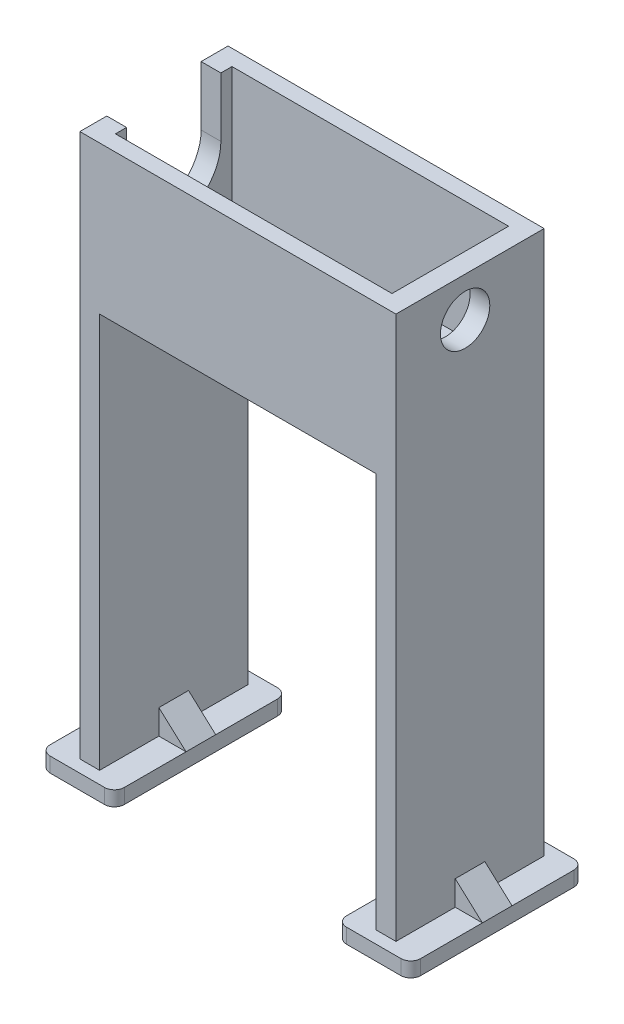
from build123d import *

# Parameters (mm, degrees)
SALIENTE_EXTRUIR1_DEPTH      = 3
SALIENTE_EXTRUIR1_2_DEPTH    = 3
SALIENTE_EXTRUIR2_DEPTH      = 3
SALIENTE_EXTRUIR2_DEPTH_BACK = 3
CROQUIS4_W                   = 4
CROQUIS4_H                   = 30
SALIENTE_EXTRUIR3_DEPTH      = 110
SALIENTE_EXTRUIR4_DEPTH      = 56
CORTAR_EXTRUIR1_DEPTH        = 4
CROQUIS7_R                   = 5
CORTAR_EXTRUIR2_DEPTH        = 4


with BuildPart() as part:
    # Croquis2 → Saliente-Extruir1 (new body)
    with BuildSketch(Plane(origin=(0, 0, 0), x_dir=(1, 0, 0), z_dir=(0, 1, 0))):
        with BuildLine():
            Line((-5.5, -17.5), (5.5, -17.5))
            ThreePointArc((5.5, -17.5), (6.914213562, -16.914213562), (7.5, -15.5))
            Line((7.5, -15.5), (7.5, 15.5))
            ThreePointArc((7.5, 15.5), (6.914213562, 16.914213562), (5.5, 17.5))
            Line((5.5, 17.5), (-5.5, 17.5))
            ThreePointArc((-5.5, 17.5), (-6.914213562, 16.914213562), (-7.5, 15.5))
            Line((-7.5, 15.5), (-7.5, -15.5))
            ThreePointArc((-7.5, -15.5), (-6.914213562, -16.914213562), (-5.5, -17.5))
        make_face()
    extrude(amount=SALIENTE_EXTRUIR1_DEPTH)



with BuildPart() as body_2:
    # Croquis2 → Saliente-Extruir1 2 (new body)
    with BuildSketch(Plane(origin=(0, 0, 0), x_dir=(1, 0, 0), z_dir=(0, 1, 0))):
        with BuildLine():
            Line((52.5, -15.5), (52.5, 15.5))
            ThreePointArc((52.5, 15.5), (53.085786438, 16.914213562), (54.5, 17.5))
            Line((54.5, 17.5), (65.5, 17.5))
            ThreePointArc((65.5, 17.5), (66.914213562, 16.914213562), (67.5, 15.5))
            Line((67.5, 15.5), (67.5, -15.5))
            ThreePointArc((67.5, -15.5), (66.914213562, -16.914213562), (65.5, -17.5))
            Line((65.5, -17.5), (54.5, -17.5))
            ThreePointArc((54.5, -17.5), (53.085786438, -16.914213562), (52.5, -15.5))
        make_face()
    extrude(amount=SALIENTE_EXTRUIR1_2_DEPTH)


with BuildPart() as part_1:
    add(part.part)

    add(body_2.part)  # Saliente-Extruir2 merges body 2
    # Croquis3 → Saliente-Extruir2 (add, two sides: drawn at the far end of the back side and taken through both)
    with BuildSketch(Plane.XY.offset(-SALIENTE_EXTRUIR2_DEPTH_BACK)):
        Polygon((-7.5, 3), (-2, 8), (-2, 3), align=None)
        Polygon((2, 3), (7.5, 3), (2, 8), align=None)
        Polygon((52.5, 3), (58, 8), (58, 3), align=None)
        Polygon((62, 3), (67.5, 3), (62, 8), align=None)
    extrude(amount=SALIENTE_EXTRUIR2_DEPTH + SALIENTE_EXTRUIR2_DEPTH_BACK)

    # Croquis4 → Saliente-Extruir3 (add)
    with BuildSketch(Plane(origin=(0, 3, 0), x_dir=(1, 0, 0), z_dir=(0, 1, 0))):
        Rectangle(CROQUIS4_W, CROQUIS4_H)
        with Locations((60, 0)):
            Rectangle(CROQUIS4_W, CROQUIS4_H)
    extrude(amount=SALIENTE_EXTRUIR3_DEPTH)

    # Croquis5 → Saliente-Extruir4 (add)
    with BuildSketch(Plane(origin=(2, 0, 0), x_dir=(0, 0, -1), z_dir=(1, 0, 0))):
        Polygon((-15, 113), (-11.8, 113), (-11.8, 89), (11.8, 89), (11.8, 113), (15, 113), (15, 83), (11.5, 83), (-11.5, 83), (-15, 83), align=None)
    extrude(amount=SALIENTE_EXTRUIR4_DEPTH)

    # Croquis6 → Cortar-Extruir1 (cut)
    with BuildSketch(Plane.ZY.offset(2)):
        with BuildLine():
            Line((-9.55, 101), (-9.55, 113))
            Line((-9.55, 113), (9.55, 113))
            Line((9.55, 113), (9.55, 101))
            ThreePointArc((9.55, 101), (0, 91.45), (-9.55, 101))
        make_face()
    extrude(amount=-CORTAR_EXTRUIR1_DEPTH, mode=Mode.SUBTRACT)

    # Croquis7 → Cortar-Extruir2 (cut)
    with BuildSketch(Plane(origin=(62, 0, 0), x_dir=(0, 0, -1), z_dir=(1, 0, 0))):
        with Locations((-1, 105)):
            Circle(CROQUIS7_R)
    extrude(amount=-CORTAR_EXTRUIR2_DEPTH, mode=Mode.SUBTRACT)


solid = part_1.part
